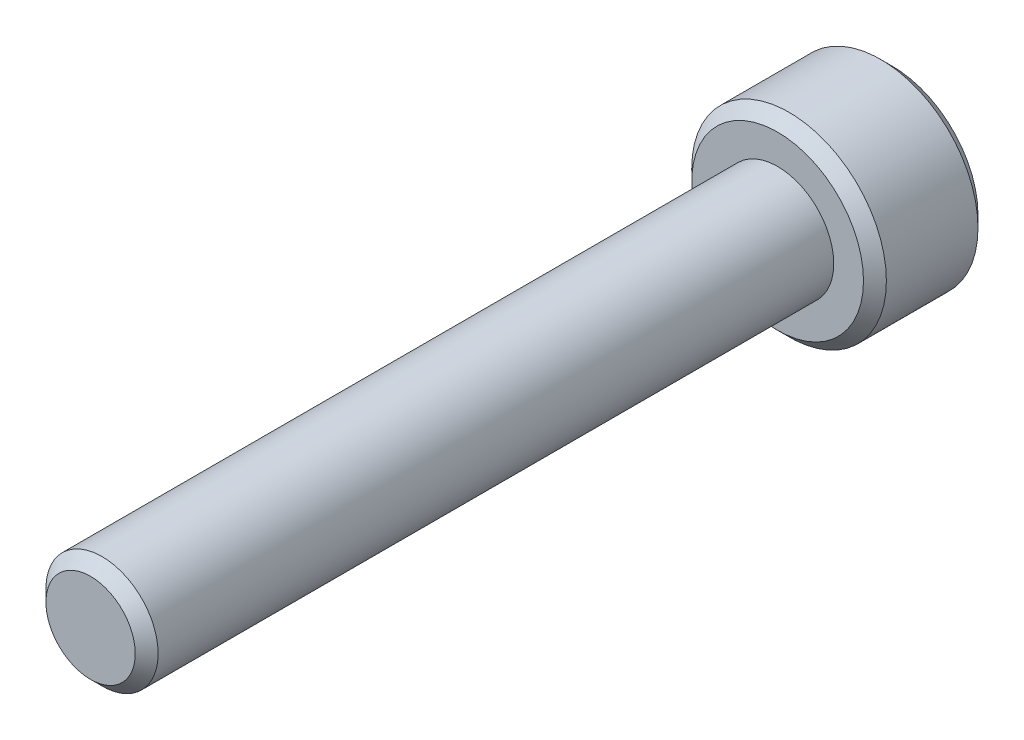
from build123d import *

# Parameters (mm, degrees)
SKIZZE1_R                       = 4.25
SKIZZE1_R_2                     = 2.45
AUFSATZ_LINEAR_AUSTRAGEN1_DEPTH = 5
SKIZZE1_3_R                     = 2.45
AUFSATZ_LINEAR_AUSTRAGEN2_DEPTH = 35
FASE1_SIZE                      = 0.5


with BuildPart() as part:
    # Skizze1 → Aufsatz-Linear austragen1 (new body)
    # profile 1 of 2: a face of its own
    with BuildSketch(Plane.XY):
        Circle(SKIZZE1_R)
        Circle(SKIZZE1_R_2, mode=Mode.SUBTRACT)
    # profile 2 of 2: a face of its own
    with BuildSketch(Plane.XY):
        Circle(SKIZZE1_R_2)
    extrude(amount=AUFSATZ_LINEAR_AUSTRAGEN1_DEPTH)

    # Skizze1<3> → Aufsatz-Linear austragen2 (add)
    with BuildSketch(Plane.XY):
        Circle(SKIZZE1_3_R)
    extrude(amount=AUFSATZ_LINEAR_AUSTRAGEN2_DEPTH)

    # Fase1
    fase1_edges = [part.edges().sort_by_distance(p)[0] for p in [
        (-4.25, 0, 0),
        (-4.25, 0, 5),
        (-2.45, 0, 35),
    ]]
    chamfer(fase1_edges, length=FASE1_SIZE)


solid = part.part
